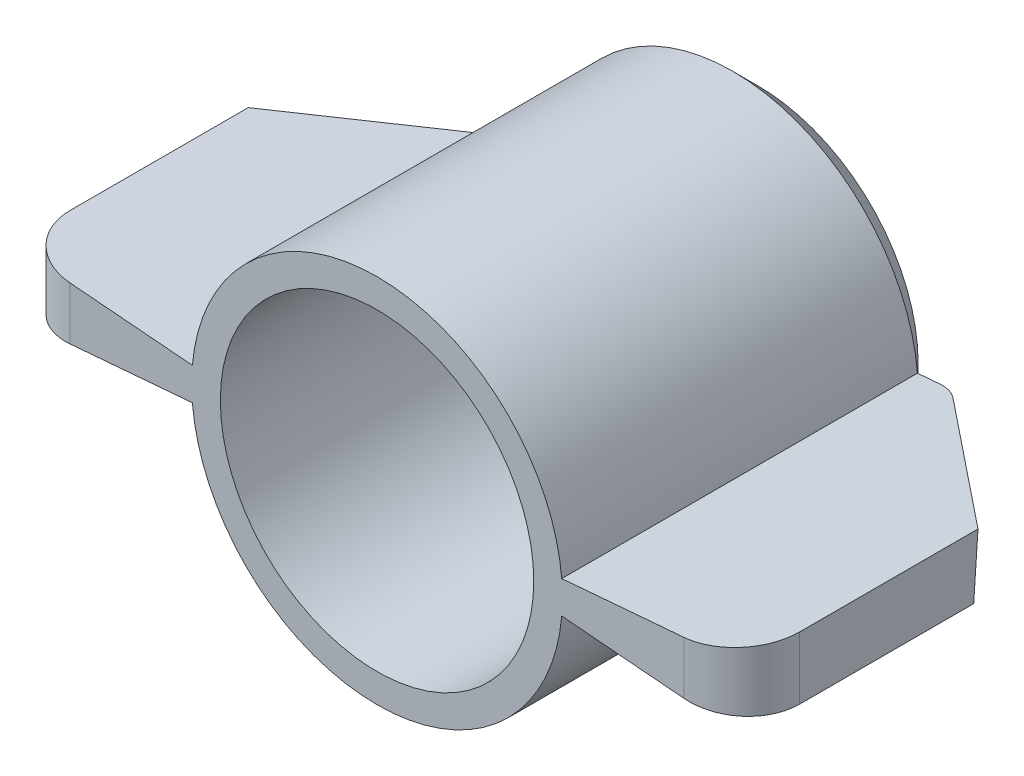
from build123d import *

# Parameters (mm, degrees)
IZIM1_R                     = 5.04
Y_KSEKLIK_EKSTR_ZYON1_DEPTH = 10.35
PAH1_SIZE                   = 0.68
IZIM2_R                     = 4.26
KES_EKSTR_ZYON1_DEPTH       = 10.35
Y_KSEKLIK_EKSTR_ZYON2_DEPTH = 9.67
KES_EKSTR_ZYON2_DEPTH       = 16.20471315
KES_EKSTR_ZYON2_DEPTH_BACK  = 16.20471315
KES_EKSTR_ZYON3_DEPTH       = 16.20471315
KES_EKSTR_ZYON3_DEPTH_BACK  = 16.20471315
RADYUS1_R                   = 0.84
RADYUS4_R                   = 0.84
RADYUS5_R                   = 1.57
RADYUS6_R                   = 1.57


with BuildPart() as part:
    # Çizim1 → Yükseklik-Ekstrüzyon1 (new body)
    with BuildSketch(Plane.XY):
        Circle(IZIM1_R)
    extrude(amount=Y_KSEKLIK_EKSTR_ZYON1_DEPTH)

    # Pah1
    pah1_edges = [part.edges().sort_by_distance(p)[0] for p in [
        (-5.04, 0, 0),
    ]]
    chamfer(pah1_edges, length=PAH1_SIZE)

    # Çizim2 → Kes-Ekstrüzyon1 (cut)
    with BuildSketch(Plane.XY.offset(10.35)):
        Circle(IZIM2_R)
    extrude(amount=-KES_EKSTR_ZYON1_DEPTH, mode=Mode.SUBTRACT)

    # Çizim3 → Yükseklik-Ekstrüzyon2 (add)
    with BuildSketch(Plane.XY.offset(10.35)):
        Polygon((5.01, 0.44), (9.92, 0.85), (9.92, 0), (9.92, -0.85), (5.01, -0.44), (5.01, 0), align=None)
        Polygon((-5.01, 0), (-5.01, 0.44), (-9.92, 0.85), (-9.92, 0), (-9.92, -0.85), (-5.01, -0.44), align=None)
    extrude(amount=-Y_KSEKLIK_EKSTR_ZYON2_DEPTH)

    # Çizim4 → Kes-Ekstrüzyon2 (cut, two sides: drawn at the far end of the back side and taken through both)
    with BuildSketch(Plane(origin=(0.001795297, -0.021499782, 0), x_dir=(-0.9965317468742466, -0.08321344525833854, 0), z_dir=(0.08321344525833854, -0.9965317468742466, 0)).offset(-KES_EKSTR_ZYON2_DEPTH_BACK)):
        Polygon((9.956326357, -0.68), (5.879953823, -0.68), (9.956326357, -4.05), align=None)
    extrude(amount=KES_EKSTR_ZYON2_DEPTH + KES_EKSTR_ZYON2_DEPTH_BACK, mode=Mode.SUBTRACT)

    # Çizim5 → Kes-Ekstrüzyon3 (cut, two sides: drawn at the far end of the back side and taken through both)
    with BuildSketch(Plane(origin=(-0.001795297, -0.021499782, 0), x_dir=(-0.9965317468742466, 0.08321344525833854, 0), z_dir=(-0.08321344525833854, -0.9965317468742466, 0)).offset(-KES_EKSTR_ZYON3_DEPTH_BACK)):
        Polygon((-9.956326357, -4.05), (-5.879953823, -0.68), (-9.956326357, -0.68), align=None)
    extrude(amount=KES_EKSTR_ZYON3_DEPTH + KES_EKSTR_ZYON3_DEPTH_BACK, mode=Mode.SUBTRACT)

    # Radyus1
    radyus1_edges = [part.edges().sort_by_distance(p)[0] for p in [
        (5.900717461, 0.003586632, 0.68),
    ]]
    fillet(radyus1_edges, radius=RADYUS1_R)

    # Radyus4
    radyus4_edges = [part.edges().sort_by_distance(p)[0] for p in [
        (-5.900717461, 0.003586632, 0.68),
    ]]
    fillet(radyus4_edges, radius=RADYUS4_R)

    # Radyus5
    radyus5_edges = [part.edges().sort_by_distance(p)[0] for p in [
        (-9.92, 0, 10.35),
    ]]
    fillet(radyus5_edges, radius=RADYUS5_R)

    # Radyus6
    radyus6_edges = [part.edges().sort_by_distance(p)[0] for p in [
        (9.92, 0, 10.35),
    ]]
    fillet(radyus6_edges, radius=RADYUS6_R)


solid = part.part
